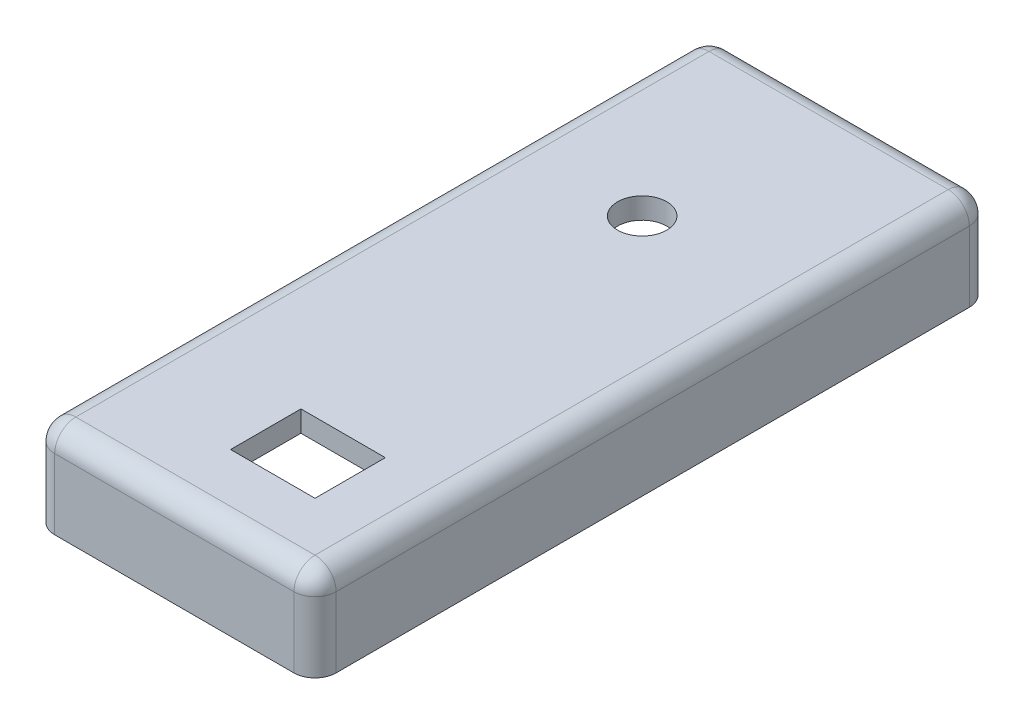
from build123d import *

# Parameters (mm, degrees)
ESBO_O1_W                = 40
ESBO_O1_H                = 96
ESBO_O1_W_2              = 34.5
ESBO_O1_H_2              = 90.5
RESSALTO_EXTRUS_O1_DEPTH = 10
ESBO_O2_W                = 40
ESBO_O2_H                = 96
RESSALTO_EXTRUS_O2_DEPTH = 3
ESBO_O3_R                = 3.5
CORTE_EXTRUS_O1_DEPTH    = 3
ESBO_O4_W                = 12
ESBO_O4_H                = 10
CORTE_EXTRUS_O2_DEPTH    = 3
FILETE1_R                = 3
ESBO_O5_RX               = 3.5
ESBO_O5_RY               = 3.5
ESBO_O5_W                = 12
ESBO_O5_H                = 10
RESSALTO_EXTRUS_O3_DEPTH = 3
ESBO_O6_R                = 3.5
CORTE_EXTRUS_O3_DEPTH    = 3
ESBO_O7_W                = 12
ESBO_O7_H                = 10
CORTE_EXTRUS_O4_DEPTH    = 3
ESBO_O8_R                = 3.5
ESBO_O8_W                = 12
ESBO_O8_H                = 10
RESSALTO_EXTRUS_O4_DEPTH = 3
ESBO_O9_R                = 3.5
ESBO_O9_W                = 12
ESBO_O9_H                = 10
CORTE_EXTRUS_O5_DEPTH    = 3


with BuildPart() as part:
    # Esboço1 → Ressalto-extrusão1 (new body)
    with BuildSketch(Plane(origin=(0, 0, 0), x_dir=(1, 0, 0), z_dir=(0, 1, 0))):
        with Locations((-1.557629238, 0.07005309)):
            Rectangle(ESBO_O1_W, ESBO_O1_H)
        with Locations((-1.307629238, -0.17994691)):
            Rectangle(ESBO_O1_W_2, ESBO_O1_H_2, mode=Mode.SUBTRACT)
    extrude(amount=RESSALTO_EXTRUS_O1_DEPTH)

    # Esboço2 → Ressalto-extrusão2 (add)
    with BuildSketch(Plane(origin=(0, 10, 0), x_dir=(1, 0, 0), z_dir=(0, 1, 0))):
        with Locations((-1.557629238, 0.07005309)):
            Rectangle(ESBO_O2_W, ESBO_O2_H)
    extrude(amount=RESSALTO_EXTRUS_O2_DEPTH)

    # Esboço3 → Corte-extrusão1 (cut)
    with BuildSketch(Plane.XZ.offset(-10)):
        with Locations(Location((-4.557629238, 23.42994691, 0), (0, 0, 270))):
            Circle(ESBO_O3_R)
    extrude(amount=-CORTE_EXTRUS_O1_DEPTH, mode=Mode.SUBTRACT)

    # Esboço4 → Corte-extrusão2 (cut)
    with BuildSketch(Plane.XZ.offset(-10)):
        with Locations((-7.557629238, -36.07005309)):
            Rectangle(ESBO_O4_W, ESBO_O4_H)
    extrude(amount=-CORTE_EXTRUS_O2_DEPTH, mode=Mode.SUBTRACT)

    # Filete1
    filete1_edges = [part.edges().sort_by_distance(p)[0] for p in [
        (-21.557629238, 13, -0.07005309),
        (-1.557629238, 13, 47.92994691),
        (18.442370762, 13, -0.07005309),
        (-1.557629238, 13, -48.07005309),
        (-21.557629238, 6.5, -48.07005309),
        (18.442370762, 6.5, -48.07005309),
        (18.442370762, 6.5, 47.92994691),
        (-21.557629238, 6.5, 47.92994691),
    ]]
    fillet(filete1_edges, radius=FILETE1_R)

    # Esboço5 → Ressalto-extrusão3 (add)
    with BuildSketch(Plane.XZ.offset(-10)):
        with Locations(Location((-4.557629238, 23.42994691), (0, 0, -90))):
            Ellipse(ESBO_O5_RX, ESBO_O5_RY)
        with Locations((-7.557629238, -36.07005309)):
            Rectangle(ESBO_O5_W, ESBO_O5_H)
    extrude(amount=-RESSALTO_EXTRUS_O3_DEPTH)

    # Esboço6 → Corte-extrusão3 (cut)
    with BuildSketch(Plane.XZ.offset(-10)):
        with Locations(Location((-2.557629238, 20.92994691, 0), (0, 0, 270))):
            Circle(ESBO_O6_R)
    extrude(amount=-CORTE_EXTRUS_O3_DEPTH, mode=Mode.SUBTRACT)

    # Esboço7 → Corte-extrusão4 (cut)
    with BuildSketch(Plane.XZ.offset(-10)):
        with Locations((-7.557629238, -36.07005309)):
            Rectangle(ESBO_O7_W, ESBO_O7_H)
    extrude(amount=-CORTE_EXTRUS_O4_DEPTH, mode=Mode.SUBTRACT)

    # Esboço8 → Ressalto-extrusão4 (add)
    with BuildSketch(Plane.XZ.offset(-10)):
        with Locations((-2.557629238, 20.92994691)):
            Circle(ESBO_O8_R)
        with Locations((-7.557629238, -36.07005309)):
            Rectangle(ESBO_O8_W, ESBO_O8_H)
    extrude(amount=-RESSALTO_EXTRUS_O4_DEPTH)

    # Esboço9 → Corte-extrusão5 (cut)
    with BuildSketch(Plane(origin=(0, 10, 0), x_dir=(-1, 0, 0), z_dir=(0, -1, 0))):
        with Locations(Location((3.057629238, 20.07005309, 0), (0, 0, 90))):
            Circle(ESBO_O9_R)
        with Locations((-2.442370762, -32.92994691)):
            Rectangle(ESBO_O9_W, ESBO_O9_H)
    extrude(amount=-CORTE_EXTRUS_O5_DEPTH, mode=Mode.SUBTRACT)


solid = part.part
